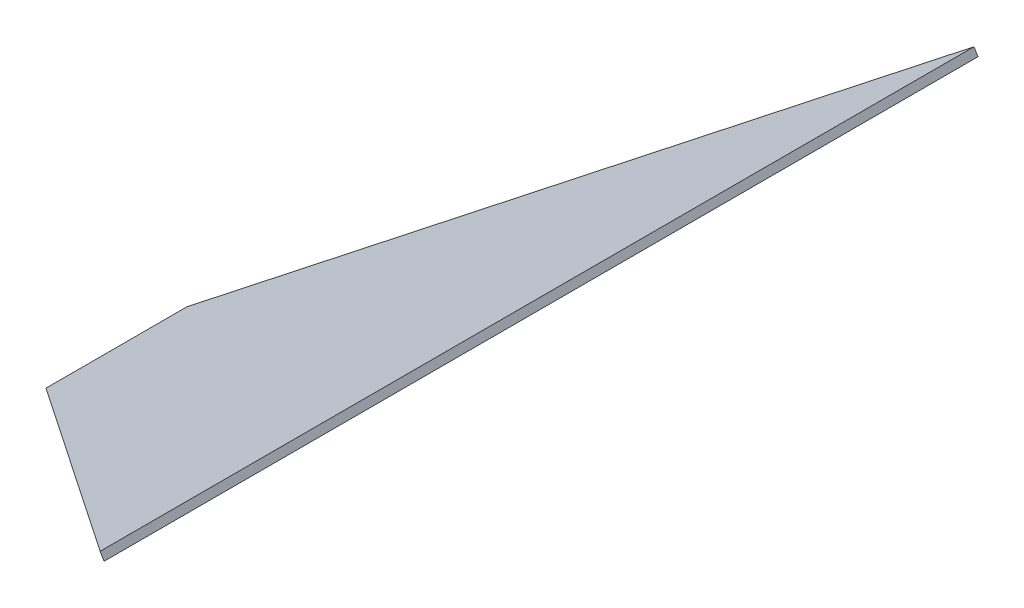
from build123d import *

# Parameters (mm, degrees)
BOSS_EXTRUDE1_DEPTH = 711.2
CUT_EXTRUDE1_DEPTH  = 848.16069371


with BuildPart() as part:
    # Sketch1 → Boss-Extrude1 (new body)
    with BuildSketch(Plane.XY):
        Polygon((50, 38.1), (46.785332178, 43.459889065), (385.585332178, 246.659889065), (388.8, 241.3), align=None)
    extrude(amount=BOSS_EXTRUDE1_DEPTH)

    # Sketch3 → Cut-Extrude1 (cut, through all)
    with BuildSketch(Plane(origin=(-6.792742869, 11.325695295, 0), x_dir=(0.8575822504737193, 0.5143468515237856, 0), z_dir=(-0.5143468515237856, 0.8575822504737193, 0))):
        Polygon((62.475727567, -412.372137739), (457.539874257, -707.582940078), (457.539874257, -711.2), (62.475727567, -711.2), align=None)
        Polygon((62.475727567, -298.827862261), (457.539874257, -3.617059922), (457.539874257, 0), (62.475727567, 0), align=None)
    extrude(amount=-CUT_EXTRUDE1_DEPTH, mode=Mode.SUBTRACT)


solid = part.part
